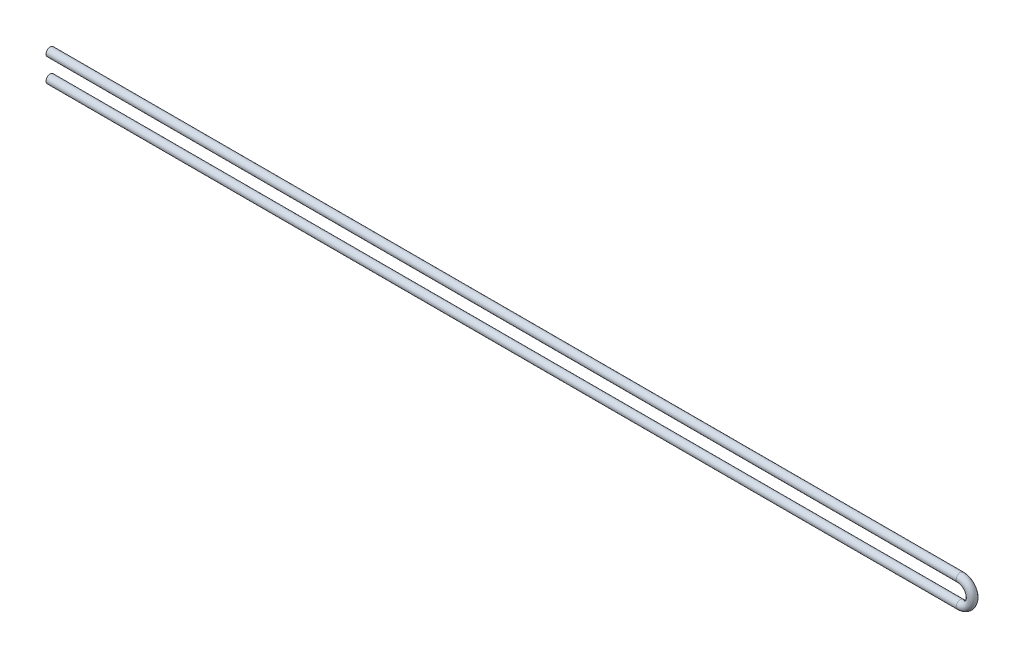
from build123d import *

# Parameters (mm, degrees)
SWEEP_THIN1_PROFILE_R   = 10.65
SWEEP_THIN1_PROFILE_R_2 = 10.15


with BuildPart() as part:
    # Sweep-Thin1: sweep along a path in Sketch1
    with BuildLine(Plane.XY) as sweep_thin1_path:
        Line((0, 0), (2325, 0))
        ThreePointArc((2325, 0), (2355, -30), (2325, -60))
        Line((2325, -60), (0, -60))
    # Sweep-Thin1 profile (on start of the path) → Sweep-Thin1 (sweep)
    with BuildSketch(Plane(origin=(0, 0, 0), x_dir=(0, 0, 1), z_dir=(1, 0, 0))):
        Circle(SWEEP_THIN1_PROFILE_R)
        Circle(SWEEP_THIN1_PROFILE_R_2, mode=Mode.SUBTRACT)
    sweep(path=sweep_thin1_path.line)


solid = part.part
